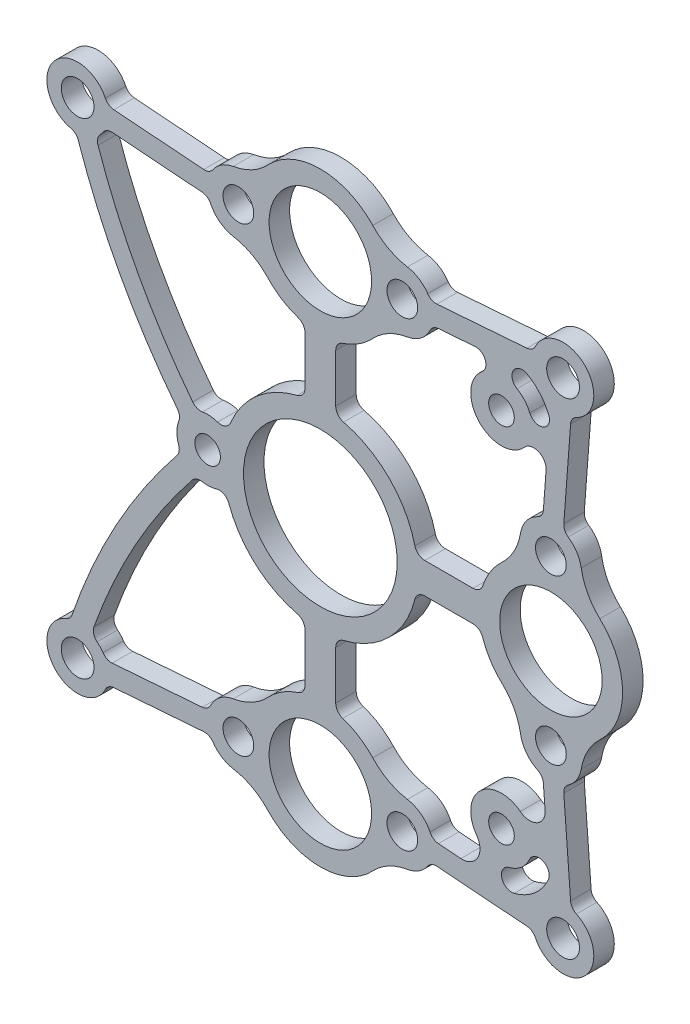
from build123d import *

# Parameters (mm, degrees)
SKETCH_1_R                  = 3
SKETCH_1_R_2                = 1.6
EXTRUDE_1_DEPTH             = 2
EXTRUDE_1_2_DEPTH           = 2
EXTRUDE_1_3_DEPTH           = 2
EXTRUDE_1_4_DEPTH           = 2
SKETCH_1_R_3                = 9.5
SKETCH_1_R_4                = 7.5
EXTRUDE_1_5_DEPTH           = 2
SKETCH_1_R_5                = 5
SKETCH_1_R_6                = 1.5
EXTRUDE_1_6_DEPTH           = 2
EXTRUDE_1_7_DEPTH           = 2
EXTRUDE_1_8_DEPTH           = 2
SKETCH_2_R                  = 3
EXTRUDE_2_DEPTH             = 2
SKETCH_4_W                  = 1.25
SKETCH_4_H                  = 2
HOLE_WIZARD_M3_1_AT_2_COUNT = 2
HOLE_WIZARD_M3_1_AT_2_PITCH = 33.688448385
HOLE_WIZARD_M3_1_AT_3_COUNT = 2
HOLE_WIZARD_M3_1_AT_3_PITCH = 33.688448385
EXTRUDE_3_DEPTH             = 2
EXTRUDE_4_DEPTH             = 2
EXTRUDE_5_DEPTH             = 2
EXTRUDE_6_DEPTH             = 2
CUT_EXTRUDE_1_DEPTH         = 2
FILLET_1_R                  = 1


with BuildPart() as part:
    # ｽｹｯﾁ1 → ﾎﾞｽ - 押し出し1 (new body)
    with BuildSketch(Plane.XY):
        with Locations((23.68807717, 23.68807717)):
            Circle(SKETCH_1_R)
        with Locations((23.68807717, 23.68807717)):
            Circle(SKETCH_1_R_2, mode=Mode.SUBTRACT)
    extrude(amount=-EXTRUDE_1_DEPTH)



with BuildPart() as body_2:
    # ｽｹｯﾁ1 → Extrude 1 2 (new body)
    with BuildSketch(Plane.XY):
        with Locations((-23.68807717, -23.68807717)):
            Circle(SKETCH_1_R)
        with Locations((-23.68807717, -23.68807717)):
            Circle(SKETCH_1_R_2, mode=Mode.SUBTRACT)
    extrude(amount=-EXTRUDE_1_2_DEPTH)


with BuildPart() as body_3:
    # ｽｹｯﾁ1 → Extrude 1 3 (new body)
    with BuildSketch(Plane.XY):
        with Locations((-23.68807717, 23.68807717)):
            Circle(SKETCH_1_R)
        with Locations((-23.68807717, 23.68807717)):
            Circle(SKETCH_1_R_2, mode=Mode.SUBTRACT)
    extrude(amount=-EXTRUDE_1_3_DEPTH)


with BuildPart() as body_4:
    # ｽｹｯﾁ1 → Extrude 1 4 (new body)
    with BuildSketch(Plane.XY):
        with Locations((23.68807717, -23.68807717)):
            Circle(SKETCH_1_R)
        with Locations((23.68807717, -23.68807717)):
            Circle(SKETCH_1_R_2, mode=Mode.SUBTRACT)
    extrude(amount=-EXTRUDE_1_4_DEPTH)


with BuildPart() as body_5:
    # ｽｹｯﾁ1 → Extrude 1 5 (new body)
    with BuildSketch(Plane.XY):
        Circle(SKETCH_1_R_3)
        Circle(SKETCH_1_R_4, mode=Mode.SUBTRACT)
    extrude(amount=-EXTRUDE_1_5_DEPTH)

    # ｽｹｯﾁ2 → ﾎﾞｽ - 押し出し2 (add, through all)
    with BuildSketch(Plane.XY):
        with Locations((-11, 0.25)):
            Circle(SKETCH_2_R)
        with Locations((17.6777, 17.9277)):
            Circle(SKETCH_2_R)
        with Locations((17.6777, -17.4277)):
            Circle(SKETCH_2_R)
    extrude(amount=-EXTRUDE_2_DEPTH)


with BuildPart() as body_6:
    # ｽｹｯﾁ1 → Extrude 1 6 (new body)
    with BuildSketch(Plane.XY):
        with BuildLine():
            ThreePointArc((27.278372133, 5.115384615), (29.5, 0), (27.278372133, -5.115384615))
            ThreePointArc((27.278372133, -5.115384615), (26.089890599, -6.6580072), (25.458039892, -8.5))
            ThreePointArc((25.458039892, -8.5), (22.5, -11), (19.541960108, -8.5))
            ThreePointArc((19.541960108, -8.5), (18.910109401, -6.6580072), (17.721627867, -5.115384615))
            ThreePointArc((17.721627867, -5.115384615), (15.5, 0), (17.721627867, 5.115384615))
            ThreePointArc((17.721627867, 5.115384615), (18.910109401, 6.6580072), (19.541960108, 8.5))
            ThreePointArc((19.541960108, 8.5), (22.5, 11), (25.458039892, 8.5))
            ThreePointArc((25.458039892, 8.5), (26.089890599, 6.6580072), (27.278372133, 5.115384615))
        make_face()
        with Locations((22.5, 0)):
            Circle(SKETCH_1_R_5, mode=Mode.SUBTRACT)
        with Locations((22.5, -8)):
            Circle(SKETCH_1_R_6, mode=Mode.SUBTRACT)
        with Locations((22.5, 8)):
            Circle(SKETCH_1_R_6, mode=Mode.SUBTRACT)
    extrude(amount=-EXTRUDE_1_6_DEPTH)



with BuildPart() as body_7:
    # ｽｹｯﾁ1 → Extrude 1 7 (new body)
    with BuildSketch(Plane.XY):
        with BuildLine():
            ThreePointArc((-5.115384615, 27.278372133), (0, 29.5), (5.115384615, 27.278372133))
            ThreePointArc((5.115384615, 27.278372133), (6.6580072, 26.089890599), (8.5, 25.458039892))
            ThreePointArc((8.5, 25.458039892), (11, 22.5), (8.5, 19.541960108))
            ThreePointArc((8.5, 19.541960108), (6.6580072, 18.910109401), (5.115384615, 17.721627867))
            ThreePointArc((5.115384615, 17.721627867), (0, 15.5), (-5.115384615, 17.721627867))
            ThreePointArc((-5.115384615, 17.721627867), (-6.6580072, 18.910109401), (-8.5, 19.541960108))
            ThreePointArc((-8.5, 19.541960108), (-11, 22.5), (-8.5, 25.458039892))
            ThreePointArc((-8.5, 25.458039892), (-6.6580072, 26.089890599), (-5.115384615, 27.278372133))
        make_face()
        with Locations((0, 22.5)):
            Circle(SKETCH_1_R_5, mode=Mode.SUBTRACT)
        with Locations((8, 22.5)):
            Circle(SKETCH_1_R_6, mode=Mode.SUBTRACT)
        with Locations((-8, 22.5)):
            Circle(SKETCH_1_R_6, mode=Mode.SUBTRACT)
    extrude(amount=-EXTRUDE_1_7_DEPTH)


with BuildPart() as body_8:
    # ｽｹｯﾁ1 → Extrude 1 8 (new body)
    with BuildSketch(Plane.XY):
        with BuildLine():
            ThreePointArc((5.115384615, -27.278372133), (0, -29.5), (-5.115384615, -27.278372133))
            ThreePointArc((-5.115384615, -27.278372133), (-6.6580072, -26.089890599), (-8.5, -25.458039892))
            ThreePointArc((-8.5, -25.458039892), (-11, -22.5), (-8.5, -19.541960108))
            ThreePointArc((-8.5, -19.541960108), (-6.6580072, -18.910109401), (-5.115384615, -17.721627867))
            ThreePointArc((-5.115384615, -17.721627867), (0, -15.5), (5.115384615, -17.721627867))
            ThreePointArc((5.115384615, -17.721627867), (6.6580072, -18.910109401), (8.5, -19.541960108))
            ThreePointArc((8.5, -19.541960108), (11, -22.5), (8.5, -25.458039892))
            ThreePointArc((8.5, -25.458039892), (6.6580072, -26.089890599), (5.115384615, -27.278372133))
        make_face()
        with Locations((0, -22.5)):
            Circle(SKETCH_1_R_5, mode=Mode.SUBTRACT)
        with Locations((-8, -22.5)):
            Circle(SKETCH_1_R_6, mode=Mode.SUBTRACT)
        with Locations((8, -22.5)):
            Circle(SKETCH_1_R_6, mode=Mode.SUBTRACT)
    extrude(amount=-EXTRUDE_1_8_DEPTH)


with BuildPart() as extrude_2_piece_1:
    # of the separate pieces the step leaves, piece 1, a body of its own (extrude_2_pieces)
    add(body_5.part.solids().sort_by_distance((-9.136901061, 2.601353301, 0))[0])

    # ｽｹｯﾁ4 → M3 ねじ穴1 (revolve, cut)
    with BuildSketch(Plane(origin=(-11, 0.25, 0), x_dir=(0, -1, 0), z_dir=(1, 0, 0))):
        with Locations((0.625, 1)):
            Rectangle(SKETCH_4_W, SKETCH_4_H)
    hole_wizard_m3_1 = revolve(axis=Axis((-11, 0.25, 6.35), (0, 0, -1)), mode=Mode.SUBTRACT)


with BuildPart() as extrude_2_piece_2:
    # of the separate pieces the step leaves, piece 2, a body of its own (extrude_2_pieces)
    add(body_5.part.solids().sort_by_distance((20.6777, 17.9277, 0))[0])

    # M3 ねじ穴1 at 2: M3 ねじ穴1 ×2
    with Locations(*[Vector(0.8512621202489168, 0.5247407003743074, 0) * (i * HOLE_WIZARD_M3_1_AT_2_PITCH) for i in range(1, HOLE_WIZARD_M3_1_AT_2_COUNT)]):
        add(hole_wizard_m3_1, mode=Mode.SUBTRACT)


with BuildPart() as extrude_2_piece_3:
    # of the separate pieces the step leaves, piece 3, a body of its own (extrude_2_pieces)
    add(body_5.part.solids().sort_by_distance((20.6777, -17.4277, 0))[0])

    # M3 ねじ穴1 at 3: M3 ねじ穴1 ×2
    with Locations(*[Vector(0.8512621202489168, -0.5247407003743076, 0) * (i * HOLE_WIZARD_M3_1_AT_3_PITCH) for i in range(1, HOLE_WIZARD_M3_1_AT_3_COUNT)]):
        add(hole_wizard_m3_1, mode=Mode.SUBTRACT)


with BuildPart() as body_6_1:
    add(body_6.part)

    add(body_7.part)  # ﾎﾞｽ - 押し出し3 merges body 7

    add(body_8.part)  # ﾎﾞｽ - 押し出し3 merges body 8

    add(extrude_2_piece_1.part)  # ﾎﾞｽ - 押し出し3 merges ﾎﾞｽ - 押し出し2 piece 1
    # ｽｹｯﾁ5 → ﾎﾞｽ - 押し出し3 (add, through all)
    with BuildSketch(Plane.XY):
        with BuildLine():
            Line((1.5, 9.38083152), (1.5, 15.662602834))
            ThreePointArc((1.5, 15.662602834), (0, 15.5), (-1.5, 15.662602834))
            Line((-1.5, 15.662602834), (-1.5, 9.38083152))
            ThreePointArc((-1.5, 9.38083152), (0, 9.5), (1.5, 9.38083152))
        make_face()
        with BuildLine():
            Line((15.662602834, 1.5), (9.38083152, 1.5))
            ThreePointArc((9.38083152, 1.5), (9.5, 0), (9.38083152, -1.5))
            Line((9.38083152, -1.5), (15.662602834, -1.5))
            ThreePointArc((15.662602834, -1.5), (15.5, 0), (15.662602834, 1.5))
        make_face()
        with BuildLine():
            Line((1.5, -15.662602834), (1.5, -9.38083152))
            ThreePointArc((1.5, -9.38083152), (0, -9.5), (-1.5, -9.38083152))
            Line((-1.5, -9.38083152), (-1.5, -15.662602834))
            ThreePointArc((-1.5, -15.662602834), (0, -15.5), (1.5, -15.662602834))
        make_face()
    extrude(amount=-EXTRUDE_3_DEPTH)


with BuildPart() as part_1:
    add(part.part)

    add(body_4.part)  # ﾎﾞｽ - 押し出し4 merges body 4

    add(body_6_1.part)  # ﾎﾞｽ - 押し出し4 merges body 6
    # ｽｹｯﾁ6 → ﾎﾞｽ - 押し出し4 (add, through all)
    with BuildSketch(Plane.XY):
        with BuildLine():
            Line((20.792211166, 24.471633223), (10.744836046, 23.710733282))
            ThreePointArc((10.744836046, 23.710733282), (10.991434003, 22.726544936), (10.895866004, 21.716443947))
            Line((10.895866004, 21.716443947), (20.943241124, 22.477343888))
            ThreePointArc((20.943241124, 22.477343888), (20.696643167, 23.461532233), (20.792211166, 24.471633223))
        make_face()
        with BuildLine():
            Line((23.710733282, 10.744836046), (24.471633223, 20.792211166))
            ThreePointArc((24.471633223, 20.792211166), (23.461532233, 20.696643167), (22.477343888, 20.943241124))
            Line((22.477343888, 20.943241124), (21.716443947, 10.895866004))
            ThreePointArc((21.716443947, 10.895866004), (22.726544936, 10.991434003), (23.710733282, 10.744836046))
        make_face()
        with BuildLine():
            ThreePointArc((10.895866004, -21.716443947), (10.991434003, -22.726544936), (10.744836046, -23.710733282))
            Line((10.744836046, -23.710733282), (20.792211166, -24.471633223))
            ThreePointArc((20.792211166, -24.471633223), (20.696643167, -23.461532233), (20.943241124, -22.477343888))
            Line((20.943241124, -22.477343888), (10.895866004, -21.716443947))
        make_face()
        with BuildLine():
            Line((21.716443947, -10.895866004), (22.477343888, -20.943241124))
            ThreePointArc((22.477343888, -20.943241124), (23.461532233, -20.696643167), (24.471633223, -20.792211166))
            Line((24.471633223, -20.792211166), (23.710733282, -10.744836046))
            ThreePointArc((23.710733282, -10.744836046), (22.726544936, -10.991434003), (21.716443947, -10.895866004))
        make_face()
    extrude(amount=-EXTRUDE_4_DEPTH)


    add(extrude_2_piece_2.part)  # ﾎﾞｽ - 押し出し5 merges ﾎﾞｽ - 押し出し2 piece 2

    add(extrude_2_piece_3.part)  # ﾎﾞｽ - 押し出し5 merges ﾎﾞｽ - 押し出し2 piece 3
    # ｽｹｯﾁ7 → ﾎﾞｽ - 押し出し5 (add, through all)
    with BuildSketch(Plane.XY):
        with BuildLine():
            ThreePointArc((15.576918066, -20.20286365), (15.022490545, -21.472943105), (13.71417001, -21.929877538))
            Line((13.71417001, -21.929877538), (20.943241124, -22.477343888))
            ThreePointArc((20.943241124, -22.477343888), (21.566756826, -21.566756826), (22.477343888, -20.943241124))
            Line((22.477343888, -20.943241124), (21.933361609, -13.760175759))
            ThreePointArc((21.933361609, -13.760175759), (21.936573475, -13.816771514), (21.937644607, -13.873448213))
            ThreePointArc((21.937644607, -13.873448213), (21.097200404, -15.220662431), (19.517663073, -15.05819881))
            ThreePointArc((19.517663073, -15.05819881), (20.372128438, -16.108588409), (20.6777, -17.4277))
            ThreePointArc((20.6777, -17.4277), (18.602437065, -20.281620349), (15.247792426, -19.187117284))
            ThreePointArc((15.247792426, -19.187117284), (15.492583393, -19.668994666), (15.576918066, -20.20286365))
        make_face()
        with BuildLine():
            ThreePointArc((22.033524953, 15.12856269), (22.032660552, 15.08282475), (22.030068583, 15.037152131))
            Line((22.030068583, 15.037152131), (22.477343888, 20.943241124))
            ThreePointArc((22.477343888, 20.943241124), (21.566756826, 21.566756826), (20.943241124, 22.477343888))
            Line((20.943241124, 22.477343888), (15.085252651, 22.033711294))
            ThreePointArc((15.085252651, 22.033711294), (15.840651855, 21.769886151), (16.160767687, 21.036566631))
            ThreePointArc((16.160767687, 21.036566631), (16.063328779, 20.606004818), (15.790000737, 20.259349951))
            ThreePointArc((15.790000737, 20.259349951), (18.969385374, 20.635383308), (20.6777, 17.9277))
            ThreePointArc((20.6777, 17.9277), (20.481553788, 16.860739862), (19.918764042, 15.93329985))
            ThreePointArc((19.918764042, 15.93329985), (21.253546457, 16.259913167), (22.033524953, 15.12856269))
        make_face()
    extrude(amount=-EXTRUDE_5_DEPTH)


    add(body_2.part)  # ﾎﾞｽ - 押し出し6 merges body 2

    add(body_3.part)  # ﾎﾞｽ - 押し出し6 merges body 3
    # ｽｹｯﾁ8 → ﾎﾞｽ - 押し出し6 (add, through all)
    with BuildSketch(Plane.XY):
        with BuildLine():
            Line((-20.943241124, 22.477343888), (-10.895866004, 21.716443947))
            ThreePointArc((-10.895866004, 21.716443947), (-10.991434003, 22.726544936), (-10.744836046, 23.710733282))
            Line((-10.744836046, 23.710733282), (-20.792211166, 24.471633223))
            ThreePointArc((-20.792211166, 24.471633223), (-20.696643167, 23.461532233), (-20.943241124, 22.477343888))
        make_face()
        with BuildLine():
            ThreePointArc((-12.047364193, 3.061232514), (-17.782486322, 11.731687258), (-21.90682031, 21.274133509))
            ThreePointArc((-21.90682031, 21.274133509), (-22.813621955, 20.818351037), (-23.820502754, 20.691001351))
            ThreePointArc((-23.820502754, 20.691001351), (-19.541307407, 10.779558911), (-13.581887152, 1.7776972))
            ThreePointArc((-13.581887152, 1.7776972), (-12.924768053, 2.55114492), (-12.047364193, 3.061232514))
        make_face()
        with BuildLine():
            ThreePointArc((-12.089203899, -2.545287976), (-12.958897212, -2.022162343), (-13.60439977, -1.238993566))
            ThreePointArc((-13.60439977, -1.238993566), (-19.895990962, -10.507635978), (-24.386544849, -20.770519475))
            ThreePointArc((-24.386544849, -20.770519475), (-23.350097035, -20.707176395), (-22.35414061, -21.000957289))
            ThreePointArc((-22.35414061, -21.000957289), (-18.054137122, -11.310110479), (-12.089203899, -2.545287976))
        make_face()
        with BuildLine():
            ThreePointArc((-20.943241124, -22.477343888), (-20.696643167, -23.461532233), (-20.792211166, -24.471633223))
            Line((-20.792211166, -24.471633223), (-10.744836046, -23.710733282))
            ThreePointArc((-10.744836046, -23.710733282), (-10.991434003, -22.726544936), (-10.895866004, -21.716443947))
            Line((-10.895866004, -21.716443947), (-20.943241124, -22.477343888))
        make_face()
    extrude(amount=-EXTRUDE_6_DEPTH)

    # ｽｹｯﾁ9 → ｶｯﾄ - 押し出し1 (cut)
    with BuildSketch(Plane.XY):
        with BuildLine():
            ThreePointArc((22.285262775, 19.869442846), (21.436328108, 21.225079982), (20.202744143, 22.243270886))
            ThreePointArc((20.202744143, 22.243270886), (18.834621137, 21.885165538), (19.192726486, 20.517042532))
            ThreePointArc((19.192726486, 20.517042532), (19.932876865, 19.906127989), (20.442237665, 19.092745707))
            ThreePointArc((20.442237665, 19.092745707), (21.752098789, 18.559581722), (22.285262775, 19.869442846))
        make_face()
        with BuildLine():
            ThreePointArc((18.919348734, -22.271077791), (20.903850111, -21.247641814), (22.244971093, -19.462407537))
            ThreePointArc((22.244971093, -19.462407537), (21.738458382, -18.142011811), (20.418062656, -18.648524522))
            ThreePointArc((20.418062656, -18.648524522), (19.613390067, -19.719665088), (18.42268924, -20.333726674))
            ThreePointArc((18.42268924, -20.333726674), (17.702343429, -21.550731979), (18.919348734, -22.271077791))
        make_face()
    extrude(amount=-CUT_EXTRUDE_1_DEPTH, mode=Mode.SUBTRACT)

    # ﾌｨﾚｯﾄ1
    fillet_1_edges = [part_1.edges().sort_by_distance(p)[0] for p in [
        (-12.047364193, 3.061232514, -1),
        (-13.581887152, 1.7776972, -1),
        (-23.820502754, 20.691001351, -1),
        (-21.90682031, 21.274133509, -1),
        (-10.744836046, 23.710733282, -1),
        (-10.895866004, 21.716443947, -1),
        (-20.943241124, 22.477343888, -1),
        (-20.792211166, 24.471633223, -1),
        (-13.60439977, -1.238993566, -1),
        (-12.089203899, -2.545287976, -1),
        (-10.895866004, -21.716443947, -1),
        (-10.744836046, -23.710733282, -1),
        (-20.792211166, -24.471633223, -1),
        (-20.943241124, -22.477343888, -1),
        (-22.35414061, -21.000957289, -1),
        (-24.386544849, -20.770519475, -1),
        (-9.136901061, 2.601353301, -1),
        (10.895866004, -21.716443947, -1),
        (21.716443947, 10.895866004, -1),
        (20.792211166, 24.471633223, -1),
        (24.471633223, 20.792211166, -1),
        (9.38083152, -1.5, -1),
        (1.5, 9.38083152, -1),
        (21.716443947, -10.895866004, -1),
        (15.662602834, 1.5, -1),
        (23.710733282, 10.744836046, -1),
        (9.38083152, 1.5, -1),
        (15.662602834, -1.5, -1),
        (-1.5, -9.38083152, -1),
        (-9.245649274, -2.183568066, -1),
        (-1.5, 9.38083152, -1),
        (1.5, 15.662602834, -1),
        (10.895866004, 21.716443947, -1),
        (-1.5, 15.662602834, -1),
        (1.5, -9.38083152, -1),
        (-1.5, -15.662602834, -1),
        (1.5, -15.662602834, -1),
        (10.744836046, -23.710733282, -1),
        (23.710733282, -10.744836046, -1),
        (24.471633223, -20.792211166, -1),
        (20.792211166, -24.471633223, -1),
        (10.744836046, 23.710733282, -1),
    ]]
    fillet(fillet_1_edges, radius=FILLET_1_R)


solid = part_1.part
